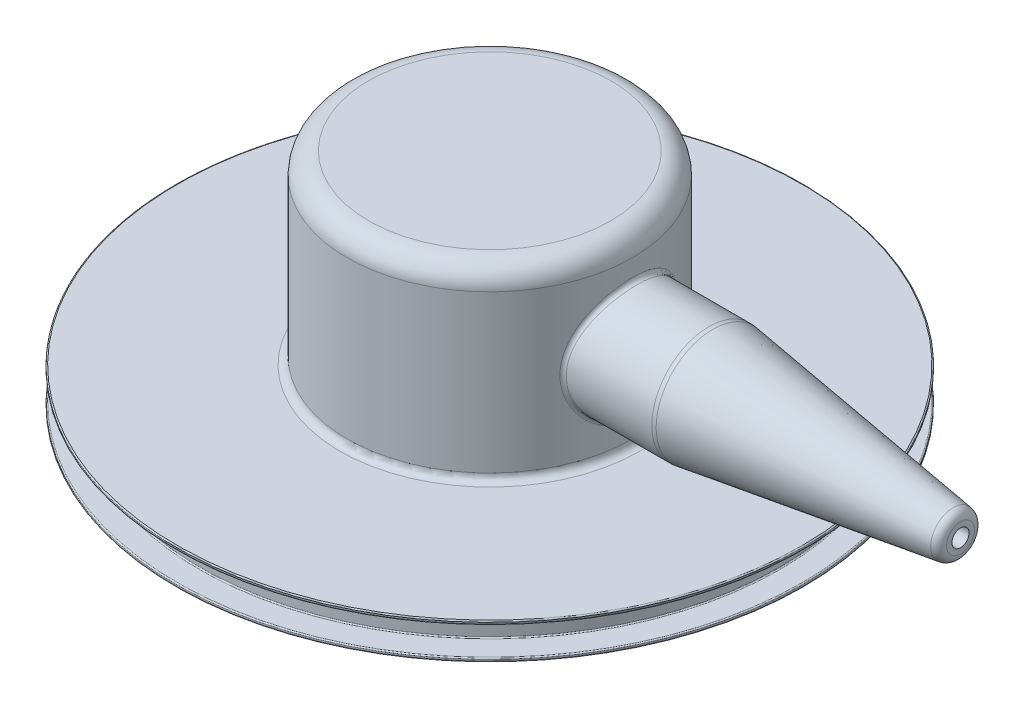
from build123d import *

# Parameters (mm, degrees)
SKETCH3_R               = 4
BOSS_EXTRUDE1_DEPTH     = 25
BOSS_EXTRUDE2_START     = 25
SKETCH3_5_R             = 3
BOSS_EXTRUDE2_DEPTH     = 8
CUT_EXTRUDE1_DEPTH      = 11.8
CUT_EXTRUDE1_DEPTH_BACK = 43.766809598
SKETCH15_R              = 1.8
FILLET1_R               = 0.5
FILLET2_R               = 0.3
FILLET3_R               = 2
FILLET4_R               = 1.5
FILLET5_R               = 0.5
FILLET6_R               = 0.08
FILLET7_R               = 0.08
FILLET8_R               = 0.6


with BuildPart() as part:
    # Sketch1 → Revolve1 (revolve)
    with BuildSketch(Plane.XY, mode=Mode.PRIVATE) as revolve1_sk:
        Polygon((0, 16), (0, 0), (19, 0), (22, 0.5), (22, 0.75), (20.274769741, 0.75), (20.274769741, 2.75), (22, 2.75), (22, 3), (10, 3), (10, 16), align=None)
    revolve(revolve1_sk.sketch.rotate(Axis((0, 16, 0), (0, -1, 0)), 180), axis=Axis((0, 16, 0), (0, -1, 0)))

    # Sketch3 → Boss-Extrude1 (add)
    with BuildSketch(Plane(origin=(0, 0, 0), x_dir=(0, 0, -1), z_dir=(1, 0, 0))):
        with Locations(Location((0, 9, 0), (0, 0, 180))):
            Circle(SKETCH3_R)
    extrude(amount=BOSS_EXTRUDE1_DEPTH)

    # Sketch3<5> → Boss-Extrude2 (add)
    with BuildSketch(Plane(origin=(0, 0, 0), x_dir=(0, 0, -1), z_dir=(1, 0, 0)).offset(BOSS_EXTRUDE2_START)):
        with Locations((0, 9)):
            Circle(SKETCH3_5_R)
    extrude(amount=BOSS_EXTRUDE2_DEPTH)

    # Sketch11 → Cut-Revolve10 (revolve, cut)
    with BuildSketch(Plane.XY):
        with BuildLine():
            Line((0, 4), (0, 0))
            Line((0, 0), (19, 0))
            ThreePointArc((19, 0), (9.694745388, 2.925040595), (0, 4))
        make_face()
    revolve(axis=Axis((0, 0, 0), (0, 1, 0)), mode=Mode.SUBTRACT)

    # Sketch15 → Cut-Extrude1 (cut, two sides: drawn at the far end of the back side and taken through both)
    with BuildSketch(Plane(origin=(0, 0, 0), x_dir=(1, 0, 0), z_dir=(0, 1, 0)).offset(-CUT_EXTRUDE1_DEPTH_BACK)):
        with Locations(Location((0, 0, 0), (0, 0, 270))):
            Circle(SKETCH15_R)
    extrude(amount=CUT_EXTRUDE1_DEPTH + CUT_EXTRUDE1_DEPTH_BACK, mode=Mode.SUBTRACT)

    # Sketch19 → Cut-Revolve14 (revolve, cut)
    with BuildSketch(Plane.XY, mode=Mode.PRIVATE) as cut_revolve14_sk:
        Polygon((33, 13), (15.5, 13), (33, 10.5), align=None)
    revolve(cut_revolve14_sk.sketch.rotate(Axis((33, 9, 0), (1, 0, 0)), 90), axis=Axis((33, 9, 0), (1, 0, 0)), mode=Mode.SUBTRACT)

    # Sketch17 → Cut-Revolve13 (revolve, cut)
    with BuildSketch(Plane.XY):
        Polygon((33, 9.6), (33, 9), (0, 9), (0, 11.8), (15.503373698, 11.8), (30.900404844, 9.6), align=None)
    revolve(axis=Axis((33, 9, 0), (-1, 0, 0)), mode=Mode.SUBTRACT)

    # Fillet1
    fillet1_edges = [part.edges().sort_by_distance(p)[0] for p in [
        (10, 3, 0),
    ]]
    fillet(fillet1_edges, radius=FILLET1_R)

    # Fillet2
    fillet2_edges = [part.edges().sort_by_distance(p)[0] for p in [
        (9.16515139, 9, -4),
    ]]
    fillet(fillet2_edges, radius=FILLET2_R)

    # Fillet3
    fillet3_edges = [part.edges().sort_by_distance(p)[0] for p in [
        (15.5, 9, -4),
    ]]
    fillet(fillet3_edges, radius=FILLET3_R)

    # Fillet4
    fillet4_edges = [part.edges().sort_by_distance(p)[0] for p in [
        (10, 16, 0),
    ]]
    fillet(fillet4_edges, radius=FILLET4_R)

    # Fillet5
    fillet5_edges = [part.edges().sort_by_distance(p)[0] for p in [
        (0, 0, -19),
    ]]
    fillet(fillet5_edges, radius=FILLET5_R)

    # Fillet6
    fillet6_edges = [part.edges().sort_by_distance(p)[0] for p in [
        (20.274769741, 0.75, 0),
        (22, 0.75, 0),
        (22, 0.5, 0),
        (22, 3, 0),
        (22, 2.75, 0),
        (20.274769741, 2.75, 0),
    ]]
    fillet(fillet6_edges, radius=FILLET6_R)

    # Fillet7
    fillet7_edges = [part.edges().sort_by_distance(p)[0] for p in [
        (-1.272792206, 3.943719446, -1.272792206),
    ]]
    fillet(fillet7_edges, radius=FILLET7_R)

    # Fillet8
    fillet8_edges = [part.edges().sort_by_distance(p)[0] for p in [
        (33, 9, -1.5),
    ]]
    fillet(fillet8_edges, radius=FILLET8_R)


solid = part.part
